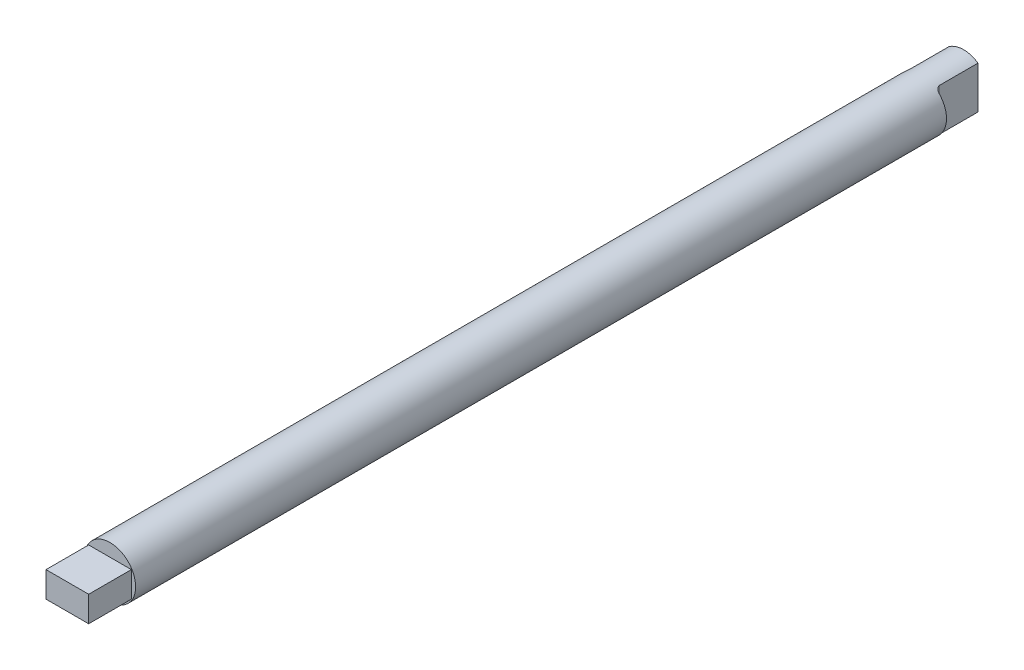
from build123d import *

# Parameters (mm, degrees)
SCHIZZO1_R                   = 6
ESTRUSIONE_ESTRUSIONE1_DEPTH = 200
SCHIZZO2_W                   = 10
SCHIZZO2_H                   = 6
ESTRUSIONE_ESTRUSIONE2_DEPTH = 10
SCHIZZO6_W                   = 2.625434249
SCHIZZO6_H                   = 12.677495408
TAGLIO_ESTRUSIONE1_DEPTH     = 10
RACCORDO2_R                  = 1
RACCORDO3_R                  = 1


with BuildPart() as part:
    # Schizzo1 → Estrusione-Estrusione1 (new body)
    with BuildSketch(Plane.XY):
        with Locations(Location((0, 0, 0), (0, 0, 180))):
            Circle(SCHIZZO1_R)
    extrude(amount=ESTRUSIONE_ESTRUSIONE1_DEPTH)

    # Schizzo2 → Estrusione-Estrusione2 (add)
    with BuildSketch(Plane.XY.offset(200)):
        Rectangle(SCHIZZO2_W, SCHIZZO2_H)
    extrude(amount=ESTRUSIONE_ESTRUSIONE2_DEPTH)

    # Schizzo6 → Taglio-Estrusione1 (cut)
    with BuildSketch(Plane(origin=(0, 0, 0), x_dir=(-1, 0, 0), z_dir=(0, 0, -1))):
        with Locations((4.687282876, 0.338747704)):
            Rectangle(SCHIZZO6_W, SCHIZZO6_H)
        with Locations((-4.687282876, 0.338747704)):
            Rectangle(SCHIZZO6_W, SCHIZZO6_H)
    extrude(amount=-TAGLIO_ESTRUSIONE1_DEPTH, mode=Mode.SUBTRACT)

    # Raccordo2
    raccordo2_edges = [part.edges().sort_by_distance(p)[0] for p in [
        (3.374565751, 0, 10),
    ]]
    fillet(raccordo2_edges, radius=RACCORDO2_R)

    # Raccordo3
    raccordo3_edges = [part.edges().sort_by_distance(p)[0] for p in [
        (-3.374565751, 0, 10),
    ]]
    fillet(raccordo3_edges, radius=RACCORDO3_R)


solid = part.part
